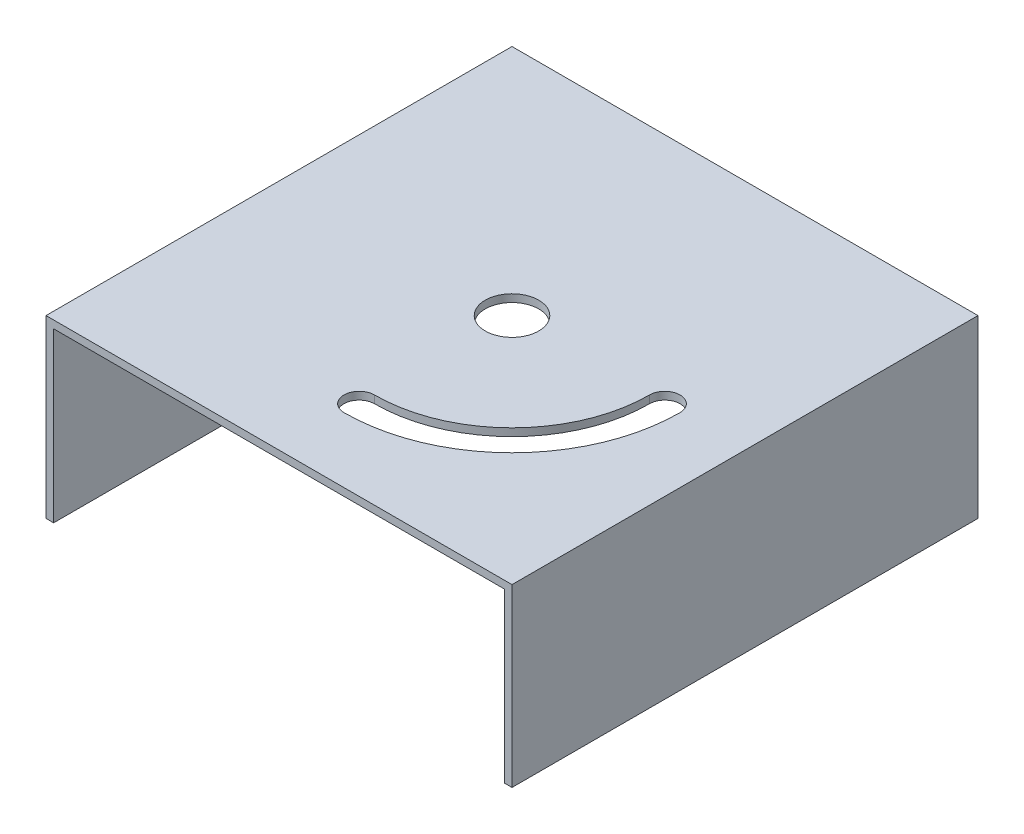
from build123d import *

# Parameters (mm, degrees)
Y_KSEKLIK_EKSTR_ZYON1_DEPTH = 610
IZIM3_W                     = 10
IZIM3_H                     = 610
Y_KSEKLIK_EKSTR_ZYON2_DEPTH = 30
IZIM2_R                     = 35
KES_EKSTR_ZYON1_DEPTH       = 10


with BuildPart() as part:
    # Çizim1 → Yükseklik-Ekstrüzyon1 (new body)
    with BuildSketch(Plane.XY):
        Polygon((0, 0), (0, 200), (610, 200), (610, 0), (600, 0), (600, 190), (10, 190), (10, 0), align=None)
    extrude(amount=Y_KSEKLIK_EKSTR_ZYON1_DEPTH)

    # Çizim3 → Yükseklik-Ekstrüzyon2 (add)
    with BuildSketch(Plane.XZ):
        with Locations((5, 305)):
            Rectangle(IZIM3_W, IZIM3_H)
        with Locations((605, 305)):
            Rectangle(IZIM3_W, IZIM3_H)
    extrude(amount=Y_KSEKLIK_EKSTR_ZYON2_DEPTH)

    # Çizim2 → Kes-Ekstrüzyon1 (cut)
    with BuildSketch(Plane(origin=(0, 200, 0), x_dir=(1, 0, 0), z_dir=(0, 1, 0))):
        with Locations(Location((305, -305, 0), (0, 0, 270))):
            Circle(IZIM2_R)
        with BuildLine():
            ThreePointArc((305, -525), (460.563491861, -460.563491861), (525, -305))
            ThreePointArc((525, -305), (505, -285), (485, -305))
            ThreePointArc((485, -305), (432.279220614, -432.279220614), (305, -485))
            ThreePointArc((305, -485), (285, -505), (305, -525))
        make_face()
    extrude(amount=-KES_EKSTR_ZYON1_DEPTH, mode=Mode.SUBTRACT)


solid = part.part
